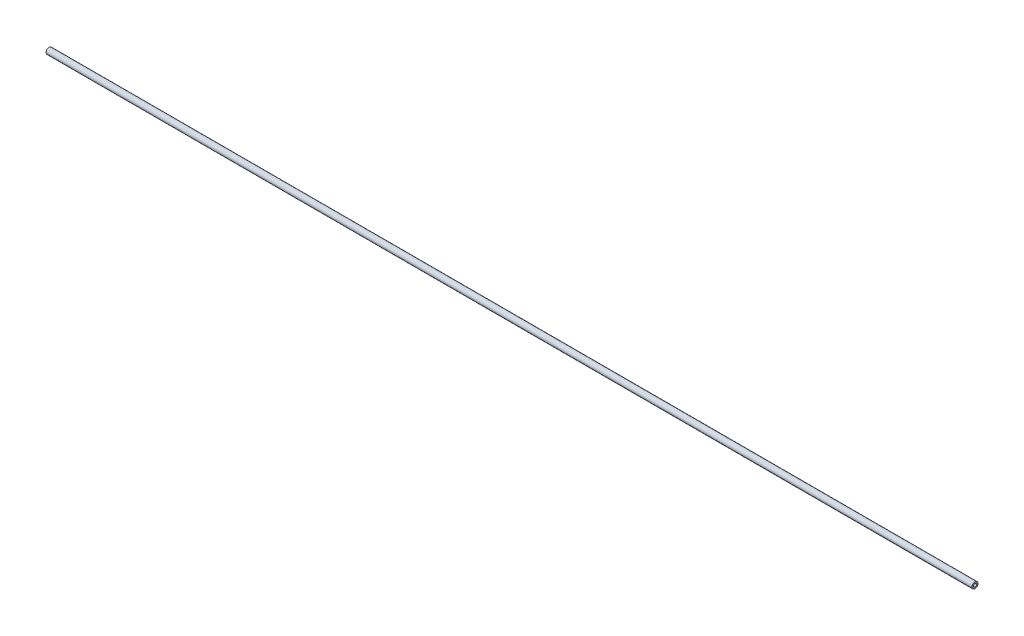
from build123d import *

# Parameters (mm, degrees)
SKETCH1_R      = 1
SKETCH1_R_2    = 0.5
EXTRUDE1_DEPTH = 152.4


with BuildPart() as part:
    # Sketch1 → Extrude1 (new, symmetric)
    with BuildSketch(Plane(origin=(0, 0, 0), x_dir=(0, 0, -1), z_dir=(1, 0, 0))):
        with Locations(Location((0, 0, 0), (0, 0, 180))):
            Circle(SKETCH1_R)
        Circle(SKETCH1_R_2, mode=Mode.SUBTRACT)
    extrude(amount=EXTRUDE1_DEPTH, both=True)


solid = part.part
